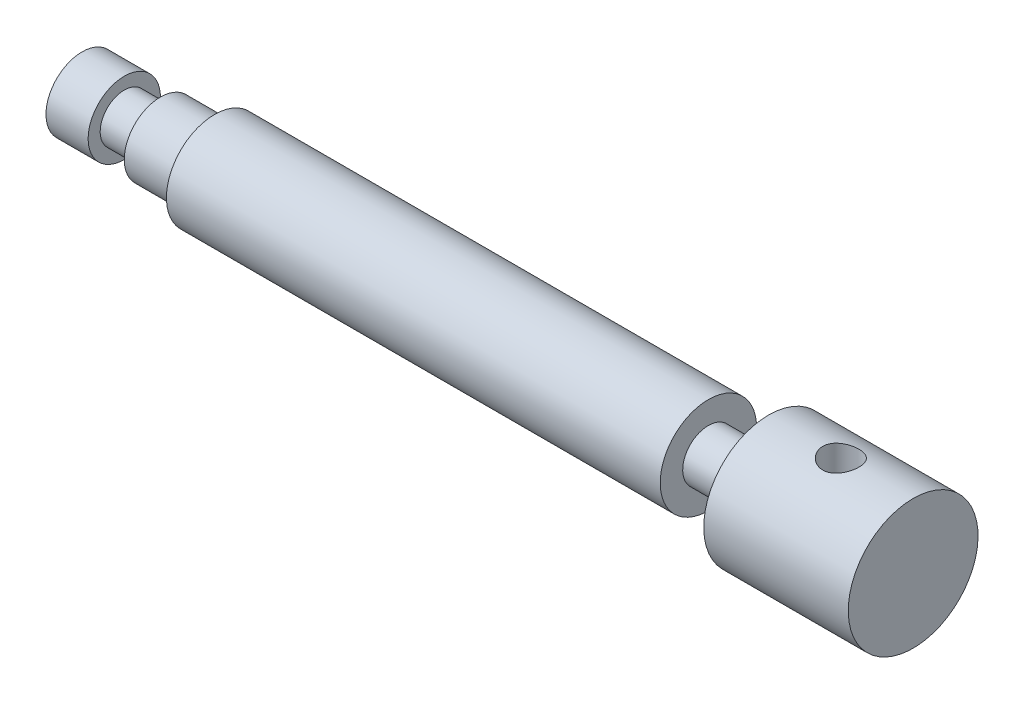
from build123d import *

# Parameters (mm, degrees)
CUT_EXTRUDE1_DEPTH      = 79.774764709
CUT_EXTRUDE1_DEPTH_BACK = 79.774764709
SKETCH2_R               = 3


with BuildPart() as part:
    # Sketch1 → Revolve1 (revolve)
    with BuildSketch(Plane.XY):
        Polygon((41, 4.267874105), (51, 4.267874105), (51, 10.774632754), (75, 10.774632754), (75, 0), (-63, 0), (-63, 6), (-56, 6), (-56, 4), (-50, 4), (-50, 6), (-41, 6), (-41, 8), (41, 8), align=None)
    revolve(axis=Axis((75, 0, 0), (-1, 0, 0)))

    # Sketch2 → Cut-Extrude1 (cut, two sides: drawn at the far end of the back side and taken through both)
    with BuildSketch(Plane(origin=(0, 10.774632754, 0), x_dir=(1, 0, 0), z_dir=(0, 1, 0)).offset(-CUT_EXTRUDE1_DEPTH_BACK)):
        with Locations(Location((63, 0, 0), (0, 0, 180))):
            Circle(SKETCH2_R)
    extrude(amount=CUT_EXTRUDE1_DEPTH + CUT_EXTRUDE1_DEPTH_BACK, mode=Mode.SUBTRACT)


solid = part.part
